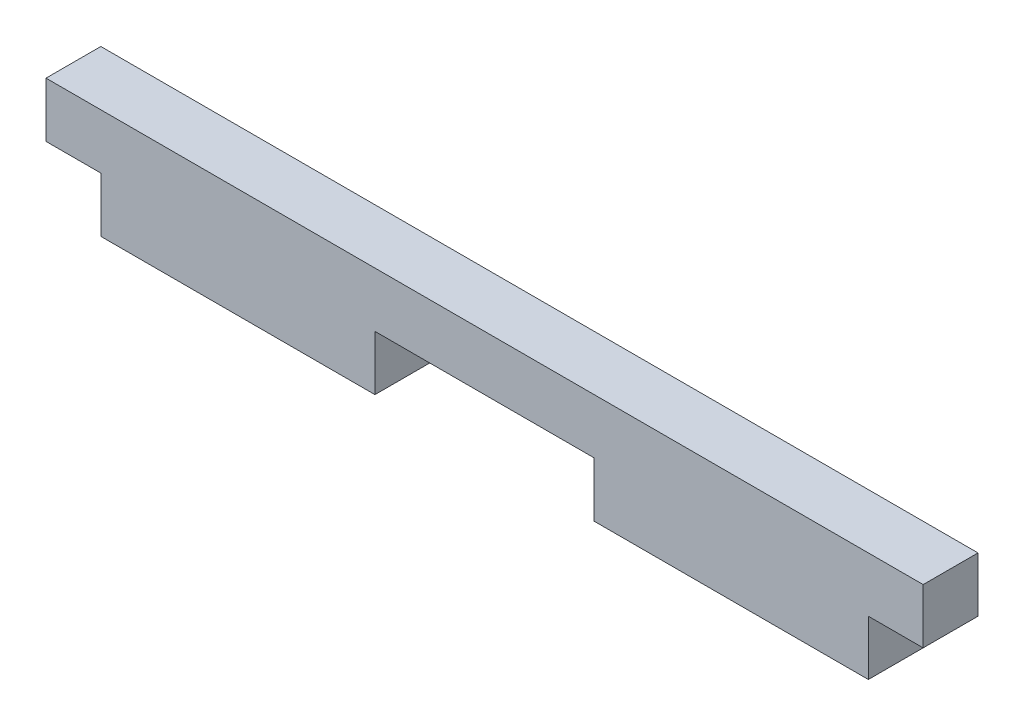
from build123d import *

# Parameters (mm, degrees)
BOSS_EXTRUDE1_DEPTH = 5


with BuildPart() as part:
    # Sketch1 → Boss-Extrude1 (new body)
    with BuildSketch(Plane.XY):
        Polygon((0, 0), (5, 0), (5, -5), (30, -5), (30, 0), (50, 0), (50, -5), (75, -5), (75, 0), (80, 0), (80, 5), (0, 5), align=None)
    extrude(amount=BOSS_EXTRUDE1_DEPTH)


solid = part.part
